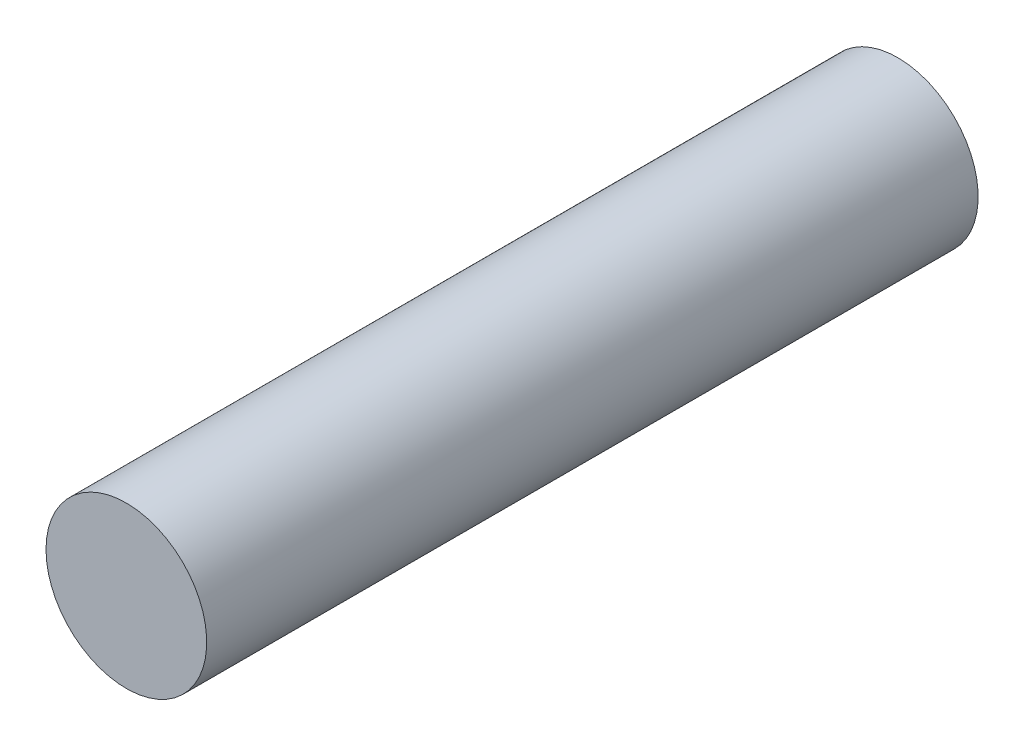
from build123d import *

# Parameters (mm, degrees)
SKETCH1_R           = 1.5875
BOSS_EXTRUDE1_DEPTH = 15.24


with BuildPart() as part:
    # Sketch1 → Boss-Extrude1 (new body)
    with BuildSketch(Plane.XY):
        with Locations(Location((0, 0, 0), (0, 0, 180))):
            Circle(SKETCH1_R)
    extrude(amount=BOSS_EXTRUDE1_DEPTH)


solid = part.part
